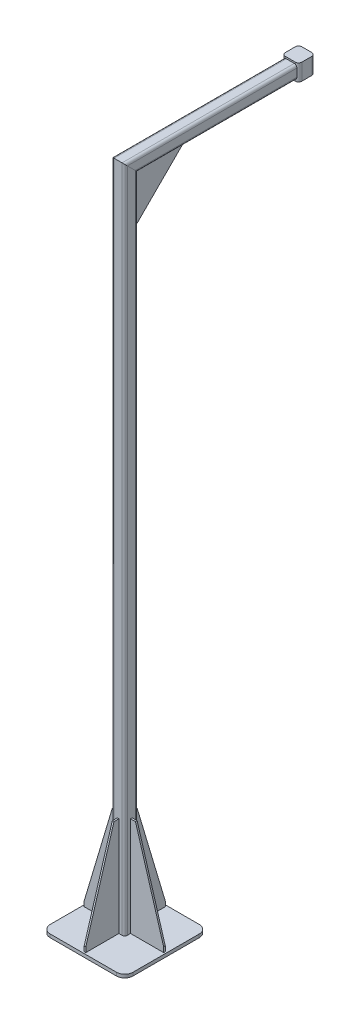
from build123d import *

# Parameters (mm, degrees)
SKETCH1_W                         = 250
SKETCH1_H                         = 250
BOSS_EXTRUDE1_DEPTH               = 10
SQUARE_TUBE_40_X_40_X_4_1_DEPTH   = 2029.284271247
SQUARE_TUBE_40_X_40_X_4_1_2_DEPTH = 529.284271247
GUSSET1_THICKNESS                 = 5
GUSSET2_THICKNESS                 = 5
GUSSET3_THICKNESS                 = 5
GUSSET4_THICKNESS                 = 5
GUSSET5_THICKNESS                 = 5
SKETCH18_W                        = 50
SKETCH18_H                        = 50
BOSS_EXTRUDE2_DEPTH               = 50
FILLET1_R                         = 10
FILLET2_R                         = 25


with BuildPart() as part:
    # Sketch1 → Boss-Extrude1 (new body)
    with BuildSketch(Plane(origin=(0, 0, 0), x_dir=(1, 0, 0), z_dir=(0, 1, 0))):
        Rectangle(SKETCH1_W, SKETCH1_H)
    extrude(amount=BOSS_EXTRUDE1_DEPTH)

    # Fillet2
    fillet2_edges = [part.edges().sort_by_distance(p)[0] for p in [
        (-125, 5, -125),
        (125, 5, -125),
        (125, 5, 125),
        (-125, 5, 125),
    ]]
    fillet(fillet2_edges, radius=FILLET2_R)


with BuildPart() as body_2:
    # Sketch12 → Square tube 40 X 40 X 4(1) (new body)
    with BuildSketch(Plane.ZX.offset(10)):
        with BuildLine():
            Line((-12, -20), (12, -20))
            ThreePointArc((12, -20), (17.656854249, -17.656854249), (20, -12))
            Line((20, -12), (20, 12))
            ThreePointArc((20, 12), (17.656854249, 17.656854249), (12, 20))
            Line((12, 20), (-12, 20))
            ThreePointArc((-12, 20), (-17.656854249, 17.656854249), (-20, 12))
            Line((-20, 12), (-20, -12))
            ThreePointArc((-20, -12), (-17.656854249, -17.656854249), (-12, -20))
        make_face()
        with BuildLine():
            Line((-12, -16), (12, -16))
            ThreePointArc((12, -16), (14.828427125, -14.828427125), (16, -12))
            Line((16, -12), (16, 12))
            ThreePointArc((16, 12), (14.828427125, 14.828427125), (12, 16))
            Line((12, 16), (-12, 16))
            ThreePointArc((-12, 16), (-14.828427125, 14.828427125), (-16, 12))
            Line((-16, 12), (-16, -12))
            ThreePointArc((-16, -12), (-14.828427125, -14.828427125), (-12, -16))
        make_face(mode=Mode.SUBTRACT)
    extrude(amount=SQUARE_TUBE_40_X_40_X_4_1_DEPTH)

    # Square tube 40 X 40 X 4(1) mitre 1
    split(bisect_by=Plane(origin=(0, 2010, 0), x_dir=(1, 0, 0), z_dir=(0, -0.707106781, 0.707106781)), keep=Keep.TOP)


with BuildPart() as body_3:
    # Sketch12 on segment 2 (carried to segment 2) → Square tube 40 X 40 X 4_1 2 (new body)
    with BuildSketch(Plane(origin=(0, 2010, 29.284271247), x_dir=(0, 1, 0), z_dir=(0, 0, -1))):
        with BuildLine():
            Line((-12, -20), (12, -20))
            ThreePointArc((12, -20), (17.656854249, -17.656854249), (20, -12))
            Line((20, -12), (20, 12))
            ThreePointArc((20, 12), (17.656854249, 17.656854249), (12, 20))
            Line((12, 20), (-12, 20))
            ThreePointArc((-12, 20), (-17.656854249, 17.656854249), (-20, 12))
            Line((-20, 12), (-20, -12))
            ThreePointArc((-20, -12), (-17.656854249, -17.656854249), (-12, -20))
        make_face()
        with BuildLine():
            Line((-12, -16), (12, -16))
            ThreePointArc((12, -16), (14.828427125, -14.828427125), (16, -12))
            Line((16, -12), (16, 12))
            ThreePointArc((16, 12), (14.828427125, 14.828427125), (12, 16))
            Line((12, 16), (-12, 16))
            ThreePointArc((-12, 16), (-14.828427125, 14.828427125), (-16, 12))
            Line((-16, 12), (-16, -12))
            ThreePointArc((-16, -12), (-14.828427125, -14.828427125), (-12, -16))
        make_face(mode=Mode.SUBTRACT)
    extrude(amount=SQUARE_TUBE_40_X_40_X_4_1_2_DEPTH)

    # Square tube 40 X 40 X 4_1 2 mitre 1
    split(bisect_by=Plane(origin=(0, 2010, 0), x_dir=(-1, 0, 0), z_dir=(0, 0.707106781, -0.707106781)), keep=Keep.TOP)


with BuildPart() as body_4:
    # Gusset1: a gusset: a plate 5.0 thick in the corner of two members, its outline drawn in place
    gusset1_outline = Wire([Line((-20, 10, 2.5), (-20, 310, 2.5)), Line((-20, 310, 2.5), (-35, 310, 2.5)), Line((-35, 310, 2.5), (-120, 25, 2.5)), Line((-120, 25, 2.5), (-120, 10, 2.5)), Line((-120, 10, 2.5), (-20, 10, 2.5))])
    add(extrude(Face(gusset1_outline), amount=GUSSET1_THICKNESS, dir=(0, 0, -1)))


with BuildPart() as body_5:
    # Gusset2: a gusset: a plate 5.0 thick in the corner of two members, its outline drawn in place
    gusset2_outline = Wire([Line((-2.5, 10, -20), (-2.5, 310, -20)), Line((-2.5, 310, -20), (-2.5, 310, -35)), Line((-2.5, 310, -35), (-2.5, 25, -120)), Line((-2.5, 25, -120), (-2.5, 10, -120)), Line((-2.5, 10, -120), (-2.5, 10, -20))])
    add(extrude(Face(gusset2_outline), amount=GUSSET2_THICKNESS, dir=(1, 0, 0)))


with BuildPart() as body_6:
    # Gusset3: a gusset: a plate 5.0 thick in the corner of two members, its outline drawn in place
    gusset3_outline = Wire([Line((20, 10, -2.5), (20, 310, -2.5)), Line((20, 310, -2.5), (35, 310, -2.5)), Line((35, 310, -2.5), (120, 25, -2.5)), Line((120, 25, -2.5), (120, 10, -2.5)), Line((120, 10, -2.5), (20, 10, -2.5))])
    add(extrude(Face(gusset3_outline), amount=GUSSET3_THICKNESS, dir=(0, 0, 1)))


with BuildPart() as body_7:
    # Gusset4: a gusset: a plate 5.0 thick in the corner of two members, its outline drawn in place
    gusset4_outline = Wire([Line((2.5, 10, 20), (2.5, 310, 20)), Line((2.5, 310, 20), (2.5, 310, 35)), Line((2.5, 310, 35), (2.5, 25, 120)), Line((2.5, 25, 120), (2.5, 10, 120)), Line((2.5, 10, 120), (2.5, 10, 20))])
    add(extrude(Face(gusset4_outline), amount=GUSSET4_THICKNESS, dir=(-1, 0, 0)))


with BuildPart() as body_8:
    # Gusset5: a gusset: a plate 5.0 thick in the corner of two members, its outline drawn in place
    gusset5_outline = Wire([Line((-2.5, 1990, -20), (-2.5, 1990, -170)), Line((-2.5, 1990, -170), (-2.5, 1975, -170)), Line((-2.5, 1975, -170), (-2.5, 1840, -35)), Line((-2.5, 1840, -35), (-2.5, 1840, -20)), Line((-2.5, 1840, -20), (-2.5, 1990, -20))])
    add(extrude(Face(gusset5_outline), amount=GUSSET5_THICKNESS, dir=(1, 0, 0)))


with BuildPart() as body_9:
    # Sketch18 → Boss-Extrude2 (new body)
    with BuildSketch(Plane(origin=(0, 0, -500), x_dir=(-1, 0, 0), z_dir=(0, 0, -1))):
        with Locations((0, 2010)):
            Rectangle(SKETCH18_W, SKETCH18_H)
    extrude(amount=BOSS_EXTRUDE2_DEPTH)

    # Fillet1
    fillet1_edges = [body_9.edges().sort_by_distance(p)[0] for p in [
        (-25, 2010, -550),
        (25, 2010, -550),
        (-25, 2010, -500),
        (25, 2010, -500),
    ]]
    fillet(fillet1_edges, radius=FILLET1_R)


solid = Compound([part.part, body_2.part, body_3.part, body_4.part, body_5.part, body_6.part, body_7.part, body_8.part, body_9.part])
